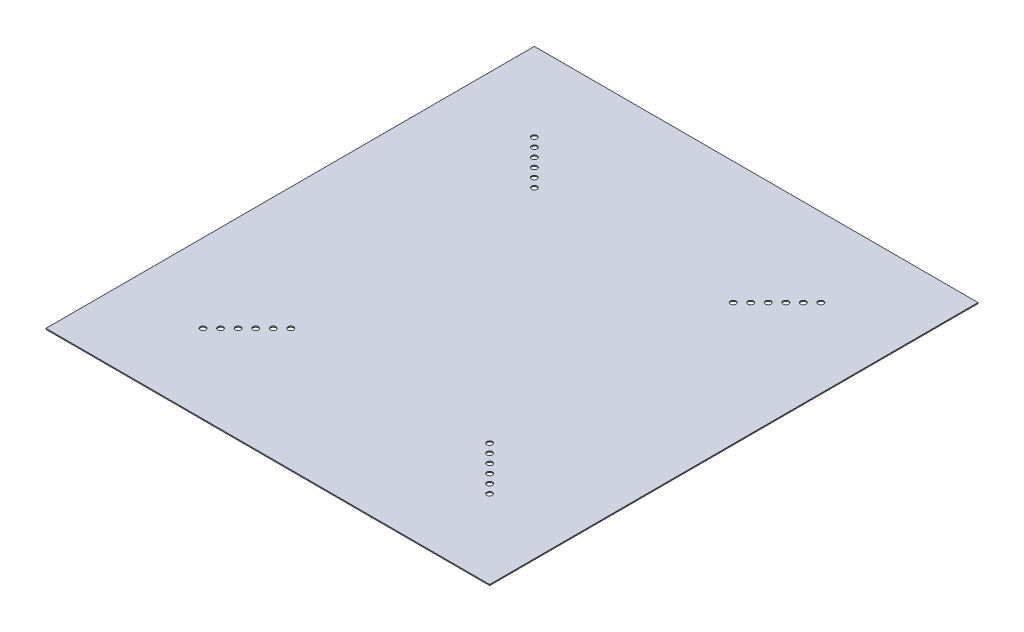
from build123d import *

# Parameters (mm, degrees)
SHEET_DEPTH              = 0.79375
FILLET1_R                = 50
M4_CLEARANCE_HOLE1_D     = 4.5
LPATTERN1_COUNT          = 6
LPATTERN1_PITCH          = 10
MIRROR1_COPY_1_D         = 4.5
MIRROR1_COPY_2_D         = 4.5
MIRROR1_COPY_3_D         = 4.5
MIRROR1_COPY_4_D         = 4.5
MIRROR1_COPY_5_D         = 4.5
MIRROR2_COPY_1_D         = 4.5
MIRROR2_COPY_2_D         = 4.5
MIRROR2_COPY_3_D         = 4.5
MIRROR2_COPY_4_D         = 4.5
MIRROR2_COPY_5_D         = 4.5
MIRROR2_COPY_6_D         = 4.5
MIRROR2_COPY_7_D         = 4.5
MIRROR2_COPY_8_D         = 4.5
MIRROR2_COPY_9_D         = 4.5
MIRROR2_COPY_10_D        = 4.5
MIRROR2_COPY_11_D        = 4.5
FULLSHEETSIDEFLAPS_DEPTH = 0.79375
CLOSECANNULUSSIDE_DEPTH  = 0.79375
SKETCH10_W               = 357.666017178
SKETCH10_H               = 393.7
EXCESSALLSIDES_DEPTH     = 0.79375


with BuildPart() as part:
    # Sketch3 → Sheet (new body)
    with BuildSketch(Plane(origin=(0, 0, 0), x_dir=(1, 0, 0), z_dir=(0, 1, 0))):
        Polygon((-57.039487758, 93.016991411), (57.039487758, 93.016991411), (110.072496347, 146.05), (128.033008589, 128.089487758), (75, 75.056479169), (75, 0), (75, -75.056479169), (128.033008589, -128.089487758), (110.072496347, -146.05), (57.039487758, -93.016991411), (-57.039487758, -93.016991411), (-110.072496347, -146.05), (-128.033008589, -128.089487758), (-75, -75.056479169), (-75, 75.056479169), (-128.033008589, 128.089487758), (-110.072496347, 146.05), align=None)
    extrude(amount=SHEET_DEPTH)

    # Fillet1
    fillet1_edges = [part.edges().sort_by_distance(p)[0] for p in [
        (75, 0.396875, -75.056479169),
        (75, 0.396875, 75.056479169),
        (57.039487758, 0.396875, 93.016991411),
        (-57.039487758, 0.396875, 93.016991411),
        (-75, 0.396875, 75.056479169),
        (-75, 0.396875, -75.056479169),
        (-57.039487758, 0.396875, -93.016991411),
        (57.039487758, 0.396875, -93.016991411),
    ]]
    fillet(fillet1_edges, radius=FILLET1_R)

    # M4 Clearance Hole1 (through all)
    with Locations(Plane(origin=(0, 0.79375, 0), x_dir=(1, 0, 0), z_dir=(0, 1, 0))):
        with Locations((115.517218562, 133.534209973)):
            m4_clearance_hole1 = Hole(M4_CLEARANCE_HOLE1_D / 2)

    # LPattern1: M4 Clearance Hole1 ×6
    with Locations(*[Vector(-0.7071067811865469, 0, 0.7071067811865482) * (i * LPATTERN1_PITCH) for i in range(1, LPATTERN1_COUNT)]):
        add(m4_clearance_hole1, mode=Mode.SUBTRACT)

    # Mirror1: M4 Clearance Hole1 across plane
    add(m4_clearance_hole1.mirror(Plane.XY), mode=Mode.SUBTRACT)

    # Mirror1 copy 1 (through all)
    with Locations(Plane(origin=(-7.071067812, 0.79375, -7.071067812), x_dir=(1, 0, 0), z_dir=(0, 1, 0))):
        with Locations((115.517218562, -133.534209973)):
            Hole(MIRROR1_COPY_1_D / 2)

    # Mirror1 copy 2 (through all)
    with Locations(Plane(origin=(-14.142135624, 0.79375, -14.142135624), x_dir=(1, 0, 0), z_dir=(0, 1, 0))):
        with Locations((115.517218562, -133.534209973)):
            Hole(MIRROR1_COPY_2_D / 2)

    # Mirror1 copy 3 (through all)
    with Locations(Plane(origin=(-21.213203436, 0.79375, -21.213203436), x_dir=(1, 0, 0), z_dir=(0, 1, 0))):
        with Locations((115.517218562, -133.534209973)):
            Hole(MIRROR1_COPY_3_D / 2)

    # Mirror1 copy 4 (through all)
    with Locations(Plane(origin=(-28.284271247, 0.79375, -28.284271247), x_dir=(1, 0, 0), z_dir=(0, 1, 0))):
        with Locations((115.517218562, -133.534209973)):
            Hole(MIRROR1_COPY_4_D / 2)

    # Mirror1 copy 5 (through all)
    with Locations(Plane(origin=(-35.355339059, 0.79375, -35.355339059), x_dir=(1, 0, 0), z_dir=(0, 1, 0))):
        with Locations((115.517218562, -133.534209973)):
            Hole(MIRROR1_COPY_5_D / 2)

    # Mirror2: M4 Clearance Hole1 across plane
    add(m4_clearance_hole1.mirror(Plane(origin=(0, 0, 0), x_dir=(0, 0, 1), z_dir=(1, 0, 0))), mode=Mode.SUBTRACT)

    # Mirror2 copy 1 (through all)
    with Locations(Plane(origin=(7.071067812, 0.79375, 7.071067812), x_dir=(-1, 0, 0), z_dir=(0, 1, 0))):
        with Locations((115.517218562, -133.534209973)):
            Hole(MIRROR2_COPY_1_D / 2)

    # Mirror2 copy 2 (through all)
    with Locations(Plane(origin=(14.142135624, 0.79375, 14.142135624), x_dir=(-1, 0, 0), z_dir=(0, 1, 0))):
        with Locations((115.517218562, -133.534209973)):
            Hole(MIRROR2_COPY_2_D / 2)

    # Mirror2 copy 3 (through all)
    with Locations(Plane(origin=(21.213203436, 0.79375, 21.213203436), x_dir=(-1, 0, 0), z_dir=(0, 1, 0))):
        with Locations((115.517218562, -133.534209973)):
            Hole(MIRROR2_COPY_3_D / 2)

    # Mirror2 copy 4 (through all)
    with Locations(Plane(origin=(28.284271247, 0.79375, 28.284271247), x_dir=(-1, 0, 0), z_dir=(0, 1, 0))):
        with Locations((115.517218562, -133.534209973)):
            Hole(MIRROR2_COPY_4_D / 2)

    # Mirror2 copy 5 (through all)
    with Locations(Plane(origin=(35.355339059, 0.79375, 35.355339059), x_dir=(-1, 0, 0), z_dir=(0, 1, 0))):
        with Locations((115.517218562, -133.534209973)):
            Hole(MIRROR2_COPY_5_D / 2)

    # Mirror2 copy 6 (through all)
    with Locations(Plane(origin=(0, 0.79375, 0), x_dir=(-1, 0, 0), z_dir=(0, 1, 0))):
        with Locations((115.517218562, 133.534209973)):
            Hole(MIRROR2_COPY_6_D / 2)

    # Mirror2 copy 7 (through all)
    with Locations(Plane(origin=(7.071067812, 0.79375, -7.071067812), x_dir=(-1, 0, 0), z_dir=(0, 1, 0))):
        with Locations((115.517218562, 133.534209973)):
            Hole(MIRROR2_COPY_7_D / 2)

    # Mirror2 copy 8 (through all)
    with Locations(Plane(origin=(14.142135624, 0.79375, -14.142135624), x_dir=(-1, 0, 0), z_dir=(0, 1, 0))):
        with Locations((115.517218562, 133.534209973)):
            Hole(MIRROR2_COPY_8_D / 2)

    # Mirror2 copy 9 (through all)
    with Locations(Plane(origin=(21.213203436, 0.79375, -21.213203436), x_dir=(-1, 0, 0), z_dir=(0, 1, 0))):
        with Locations((115.517218562, 133.534209973)):
            Hole(MIRROR2_COPY_9_D / 2)

    # Mirror2 copy 10 (through all)
    with Locations(Plane(origin=(28.284271247, 0.79375, -28.284271247), x_dir=(-1, 0, 0), z_dir=(0, 1, 0))):
        with Locations((115.517218562, 133.534209973)):
            Hole(MIRROR2_COPY_10_D / 2)

    # Mirror2 copy 11 (through all)
    with Locations(Plane(origin=(35.355339059, 0.79375, -35.355339059), x_dir=(-1, 0, 0), z_dir=(0, 1, 0))):
        with Locations((115.517218562, 133.534209973)):
            Hole(MIRROR2_COPY_11_D / 2)

    # Sketch6 → FullSheetSideFlaps (add)
    with BuildSketch(Plane(origin=(0, 0.79375, 0), x_dir=(1, 0, 0), z_dir=(0, 1, 0))):
        with BuildLine():
            Line((-128.033008589, 128.089487758), (-128.033008589, -128.089487758))
            Line((-128.033008589, -128.089487758), (-89.644660941, -89.70114011))
            ThreePointArc((-89.644660941, -89.70114011), (-78.806023374, -73.479972668), (-75, -54.34580105))
            Line((-75, -54.34580105), (-75, 54.34580105))
            ThreePointArc((-75, 54.34580105), (-78.806023374, 73.479972668), (-89.644660941, 89.70114011))
            Line((-89.644660941, 89.70114011), (-128.033008589, 128.089487758))
        make_face()
        with BuildLine():
            Line((-110.072496347, -146.05), (110.072496347, -146.05))
            Line((110.072496347, -146.05), (71.684148699, -107.661652352))
            ThreePointArc((71.684148699, -107.661652352), (55.462981257, -96.823014785), (36.328809639, -93.016991411))
            Line((36.328809639, -93.016991411), (-36.328809639, -93.016991411))
            ThreePointArc((-36.328809639, -93.016991411), (-55.462981257, -96.823014785), (-71.684148699, -107.661652352))
            Line((-71.684148699, -107.661652352), (-110.072496347, -146.05))
        make_face()
        with BuildLine():
            Line((128.033008589, 128.089487758), (128.033008589, -128.089487758))
            Line((128.033008589, -128.089487758), (89.644660941, -89.70114011))
            ThreePointArc((89.644660941, -89.70114011), (78.806023374, -73.479972668), (75, -54.34580105))
            Line((75, -54.34580105), (75, 54.34580105))
            ThreePointArc((75, 54.34580105), (78.806023374, 73.479972668), (89.644660941, 89.70114011))
            Line((89.644660941, 89.70114011), (128.033008589, 128.089487758))
        make_face()
    extrude(amount=-FULLSHEETSIDEFLAPS_DEPTH)

    # Sketch9 → CloseCannulusSide (add)
    with BuildSketch(Plane(origin=(0, 0.79375, 0), x_dir=(1, 0, 0), z_dir=(0, 1, 0))):
        with BuildLine():
            Line((110.072496347, 146.05), (71.684148699, 107.661652352))
            ThreePointArc((71.684148699, 107.661652352), (55.462981257, 96.823014785), (36.328809639, 93.016991411))
            Line((36.328809639, 93.016991411), (-36.328809639, 93.016991411))
            ThreePointArc((-36.328809639, 93.016991411), (-55.462981257, 96.823014785), (-71.684148699, 107.661652352))
            Line((-71.684148699, 107.661652352), (-110.072496347, 146.05))
            Line((-110.072496347, 146.05), (110.072496347, 146.05))
        make_face()
    extrude(amount=-CLOSECANNULUSSIDE_DEPTH)

    # Sketch10 → ExcessAllSides (add)
    with BuildSketch(Plane(origin=(0, 0.79375, 0), x_dir=(1, 0, 0), z_dir=(0, 1, 0))):
        Rectangle(SKETCH10_W, SKETCH10_H)
        Polygon((128.033008589, 128.089487758), (110.072496347, 146.05), (-110.072496347, 146.05), (-128.033008589, 128.089487758), (-128.033008589, -128.089487758), (-110.072496347, -146.05), (110.072496347, -146.05), (128.033008589, -128.089487758), align=None, mode=Mode.SUBTRACT)
    extrude(amount=-EXCESSALLSIDES_DEPTH)


solid = part.part
